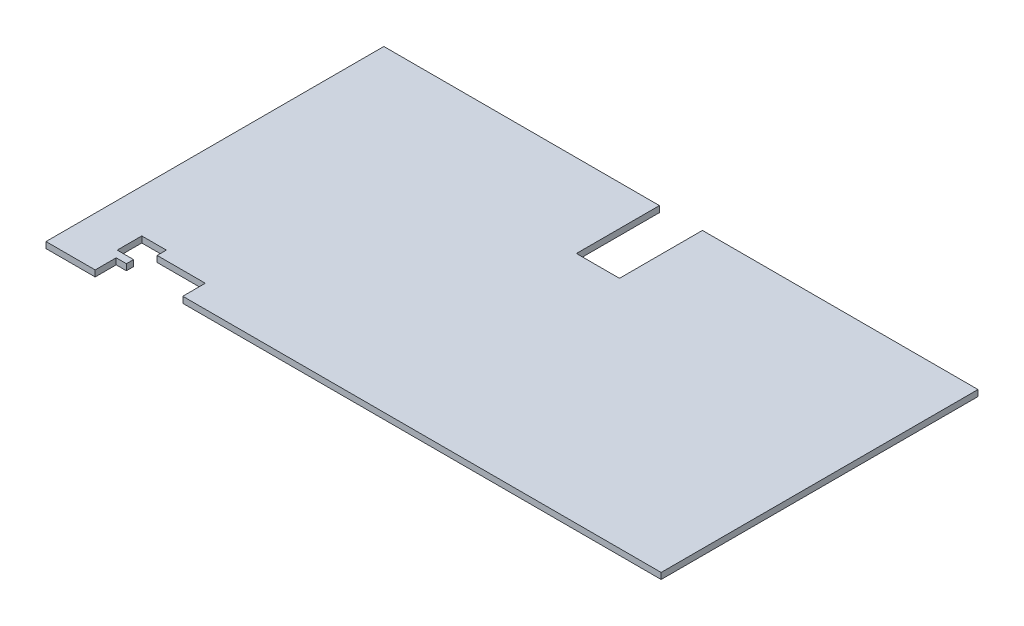
from build123d import *

# Parameters (mm, degrees)
SKETCH1_W           = 290
SKETCH1_H           = 154.65
BOSS_EXTRUDE1_DEPTH = 3
SKETCH2_W           = 21
SKETCH2_H           = 40.5
CUT_EXTRUDE1_DEPTH  = 165.356793669
CUT_EXTRUDE2_DEPTH  = 165.356793669
SKETCH4_W           = 24
SKETCH4_H           = 10.25
BOSS_EXTRUDE2_DEPTH = 3


with BuildPart() as part:
    # Sketch1 → Boss-Extrude1 (new body)
    with BuildSketch(Plane(origin=(0, 0, 0), x_dir=(1, 0, 0), z_dir=(0, 1, 0))):
        Rectangle(SKETCH1_W, SKETCH1_H)
    extrude(amount=BOSS_EXTRUDE1_DEPTH)

    # Sketch2 → Cut-Extrude1 (cut, through all)
    with BuildSketch(Plane(origin=(0, 3, 0), x_dir=(1, 0, 0), z_dir=(0, 1, 0))):
        with Locations((0, 57.075)):
            Rectangle(SKETCH2_W, SKETCH2_H)
    extrude(amount=-CUT_EXTRUDE1_DEPTH, mode=Mode.SUBTRACT)

    # Sketch3 → Cut-Extrude2 (cut, through all)
    with BuildSketch(Plane(origin=(0, 3, 0), x_dir=(1, 0, 0), z_dir=(0, 1, 0))):
        Polygon((-116, -73.825), (-116, -77.325), (-88.5, -77.325), (-88.5, -66.325), (-112, -66.325), (-112, -61.825), (-124, -61.825), (-124, -73.825), align=None)
    extrude(amount=-CUT_EXTRUDE2_DEPTH, mode=Mode.SUBTRACT)

    # Sketch4 → Boss-Extrude2 (add, through all)
    with BuildSketch(Plane(origin=(0, 3, 0), x_dir=(1, 0, 0), z_dir=(0, 1, 0))):
        with Locations((-133, -82.45)):
            Rectangle(SKETCH4_W, SKETCH4_H)
    extrude(amount=-BOSS_EXTRUDE2_DEPTH)


solid = part.part
